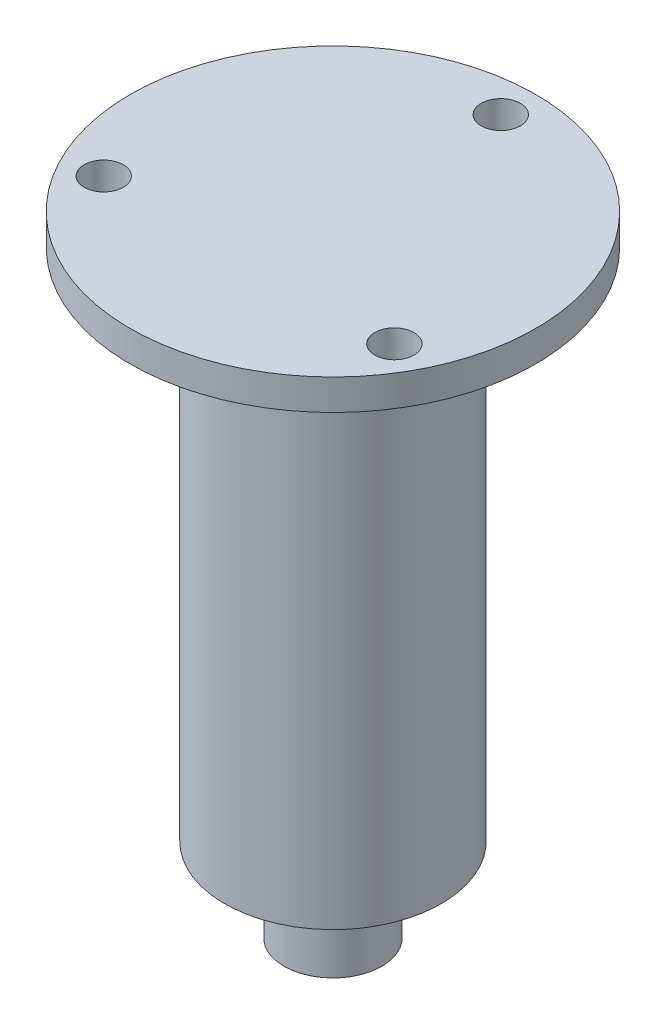
from build123d import *

# Parameters (mm, degrees)
SKETCH_2_R          = 1.4
CUT_EXTRUDE_1_DEPTH = 50.451996926


with BuildPart() as part:
    # 草图1 → 旋转1 (revolve)
    with BuildSketch(Plane.XY):
        Polygon((0, 0), (-3.5, 0), (-3.5, 6), (-7.75, 6), (-7.75, 42.8), (-14.5, 42.8), (-14.5, 45), (0, 45), align=None)
    revolve(axis=Axis((0, 45, 0), (0, -1, 0)))

    # 草图2 → 切除-拉伸1 (cut, through all)
    with BuildSketch(Plane(origin=(0, 45, 0), x_dir=(1, 0, 0), z_dir=(0, 1, 0))):
        with Locations(Location((0, 12, 0), (0, 0, 180))):
            Circle(SKETCH_2_R)
        with Locations(Location((10.392304845, -6, 0), (0, 0, 180))):
            Circle(SKETCH_2_R)
        with Locations(Location((-10.392304845, -6, 0), (0, 0, 180))):
            Circle(SKETCH_2_R)
    extrude(amount=-CUT_EXTRUDE_1_DEPTH, mode=Mode.SUBTRACT)


solid = part.part
